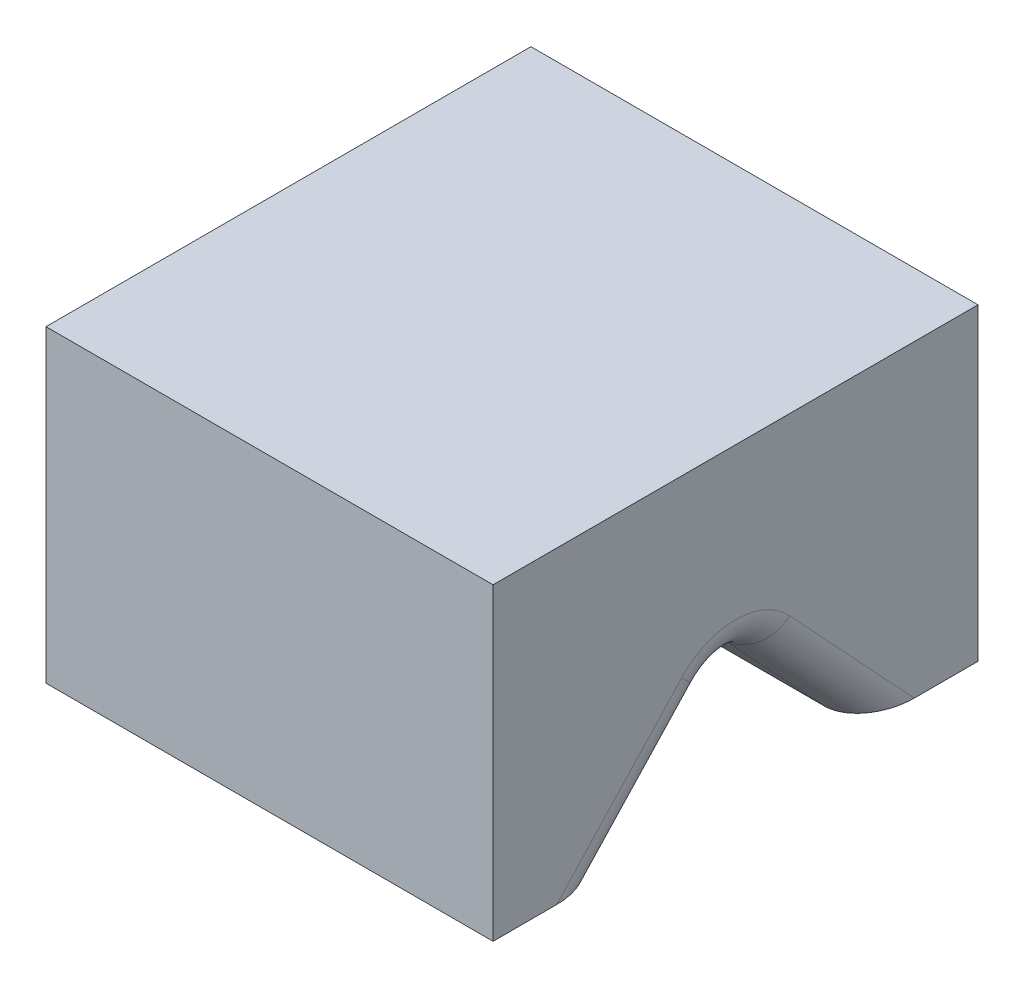
from build123d import *

# Parameters (mm, degrees)
SKETCH_TL_CUTTING_R    = 1.4986
TL_CUTTING_DEPTH       = 29.999999944
SKETCH_TDF_CUTTING_W   = 3.01719996
SKETCH_TDF_CUTTING_H   = 3.01719996
TDF_CUTTING_DEPTH      = 31.074766841
VW_VR_GRINDING_DEPTH   = 1.50859998
VW_VR_GRINDING_2_DEPTH = 1.50859998
ISA_GRINDING_DEPTH     = 1.50859998
SKETCH_PRE_FRX_BRX_W   = 1.19142002
SKETCH_PRE_FRX_BRX_H   = 0.89916
SKETCH_PRE_FRX_BRX_W_2 = 1.21633996
PRE_FRX_BRX_DEPTH      = 1.50859998
FA_BA_GRINDING_DEPTH   = 1.50859998
BR_EDM_R               = 0.09906
FR_EDM_R               = 0.0508


with BuildPart() as part:
    # sketch_TL_cutting → TL_cutting (new body)
    with BuildSketch(Plane(origin=(0, 0, 0), x_dir=(1, 0, 0), z_dir=(0, 1, 0))):
        with Locations(Location((0, 0, 0), (0, 0, 270))):
            Circle(SKETCH_TL_CUTTING_R)
    extrude(amount=TL_CUTTING_DEPTH)

    # sketch_TDF_cutting → TDF_cutting (cut, through all)
    with BuildSketch(Plane(origin=(0, 0, 0), x_dir=(1, 0, 0), z_dir=(0, 1, 0))):
        with Locations((-2.71001998, 0)):
            Rectangle(SKETCH_TDF_CUTTING_W, SKETCH_TDF_CUTTING_H)
    extrude(amount=TDF_CUTTING_DEPTH, mode=Mode.SUBTRACT)


with BuildPart() as body_2:
    # sketch_VW_VR_grinding → VW_VR_grinding (new, symmetric)
    with BuildSketch(Plane(origin=(0, 0, 0), x_dir=(0, 0, -1), z_dir=(1, 0, 0))):
        with BuildLine():
            Line((-0.32512, -0.00999998), (-0.32512, 0.876937879))
            ThreePointArc((-0.32512, 0.876937879), (-0.326086547, 0.899075438), (-0.328978831, 0.921044517))
            Line((-0.328978831, 0.921044517), (-1.51859996, 7.667721199))
            Line((-1.51859996, 7.667721199), (-1.50859998, -0.00999998))
            Line((-1.50859998, -0.00999998), (-0.32512, -0.00999998))
        make_face()
    extrude(amount=VW_VR_GRINDING_DEPTH, both=True)


with BuildPart() as body_3:
    # sketch_VW_VR_grinding → VW_VR_grinding 2 (new, symmetric)
    with BuildSketch(Plane(origin=(0, 0, 0), x_dir=(0, 0, -1), z_dir=(1, 0, 0))):
        with BuildLine():
            Line((0.32512, -0.00999998), (0.32512, 0.876937879))
            ThreePointArc((0.32512, 0.876937879), (0.326086547, 0.899075438), (0.328978831, 0.921044517))
            Line((0.328978831, 0.921044517), (1.51859996, 7.667721199))
            Line((1.51859996, 7.667721199), (1.50859998, -0.00999998))
            Line((1.50859998, -0.00999998), (0.32512, -0.00999998))
        make_face()
    extrude(amount=VW_VR_GRINDING_2_DEPTH, both=True)


    add(body_2.part)  # ISA_grinding merges body 2
    # sketch_ISA_grinding → ISA_grinding (add, symmetric)
    with BuildSketch(Plane(origin=(0, 0, 0), x_dir=(0, 0, -1), z_dir=(1, 0, 0))):
        Polygon((-0.32512, 0), (0.32512, 0), (1.50859998, 6.711848494), (1.50859998, -0.02999994), (-1.50859998, -0.02999994), (-1.50859998, 6.711848494), align=None)
    extrude(amount=ISA_GRINDING_DEPTH, both=True)

    # sketch_pre_FRX_BRX → pre_FRX_BRX (add, symmetric)
    with BuildSketch(Plane.XY):
        with Locations((0.90288999, 0.43958002)):
            Rectangle(SKETCH_PRE_FRX_BRX_W, SKETCH_PRE_FRX_BRX_H)
        with Locations((-0.91042998, 0.43958002)):
            Rectangle(SKETCH_PRE_FRX_BRX_W_2, SKETCH_PRE_FRX_BRX_H)
    extrude(amount=PRE_FRX_BRX_DEPTH, both=True)

    # sketch_FA_BA_grinding → FA_BA_grinding (add, symmetric)
    with BuildSketch(Plane.XY):
        Polygon((0.29718, -0.00999998), (0.29718, 0.89916), (1.6256, 10.351359447), (1.6256, -0.00999998), align=None)
        Polygon((-0.30226, -0.00999998), (-0.30226, 0.89916), (-1.32842, 8.200667794), (-1.32842, -0.00999998), align=None)
    extrude(amount=FA_BA_GRINDING_DEPTH, both=True)


with BuildPart() as part_1:
    add(part.part)

    # B1_fix: cut body 3
    add(body_3.part, mode=Mode.SUBTRACT)

    # V-Groove_EDM: sweep along a path in sketch_contour_V-Groove
    with BuildLine(Plane.XY) as v_groove_edm_path:
        Line((-1.20142, 0.16002), (1.4986, 0.16002))
    # sketch_section_V-Groove → V-Groove_EDM (sweep, cut)
    with BuildSketch(Plane(origin=(-1.20142, 0, -1.2954), x_dir=(0, 0, -1), z_dir=(1, 0, 0))):
        with BuildLine():
            Line((-1.26010487, 0.144673241), (-1.115869758, -0.00999998))
            Line((-1.115869758, -0.00999998), (-1.474930242, -0.00999998))
            Line((-1.474930242, -0.00999998), (-1.33069513, 0.144673241))
            ThreePointArc((-1.33069513, 0.144673241), (-1.2954, 0.16002), (-1.26010487, 0.144673241))
        make_face()
    sweep(path=v_groove_edm_path.line, mode=Mode.SUBTRACT)

    # BR_EDM
    br_edm_edges = [part_1.edges().sort_by_distance(p)[0] for p in [
        (-0.30226, 0.16002, 0),
        (-0.30226, 0.07233662, -0.102750119),
        (-0.30226, 0.07233662, 0.102750119),
    ]]
    fillet(br_edm_edges, radius=BR_EDM_R)

    # FR_EDM
    fr_edm_edges = [part_1.edges().sort_by_distance(p)[0] for p in [
        (0.29718, 0.07233662, -0.102750119),
        (0.29718, 0.07233662, 0.102750119),
        (0.29718, 0.16002, 0),
    ]]
    fillet(fr_edm_edges, radius=FR_EDM_R)

    # SurfaceCut1
    split(bisect_by=Plane(origin=(0, 0.41401793, 0), x_dir=(1, 0, 0), z_dir=(0, 1, 0)), keep=Keep.BOTTOM)


solid = part_1.part
